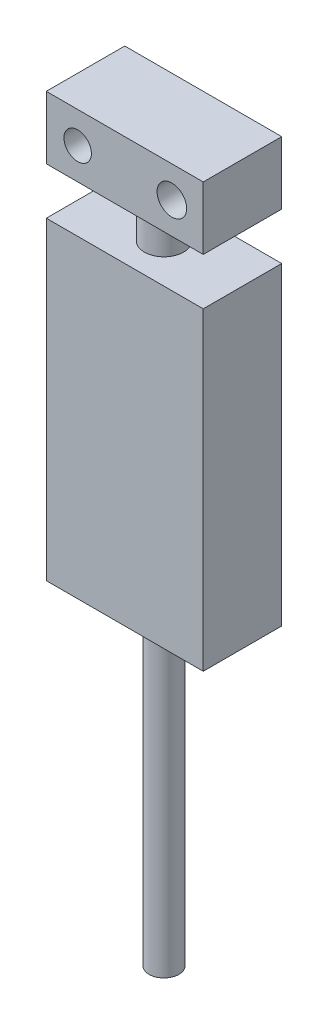
from build123d import *

# Parameters (mm, degrees)
SKETCH1_W           = 200
SKETCH1_H           = 400
BOSS_EXTRUDE1_DEPTH = 100
SKETCH2_R           = 25
BOSS_EXTRUDE2_DEPTH = 60
SKETCH3_W           = 200
SKETCH3_H           = 100
BOSS_EXTRUDE3_DEPTH = 80
SKETCH4_R           = 17.5
SKETCH4_R_2         = 18.82666719
CUT_EXTRUDE1_DEPTH  = 40
SKETCH5_R           = 19
BOSS_EXTRUDE4_DEPTH = 400
SKETCH7_R           = 10
BOSS_EXTRUDE5_DEPTH = 15


with BuildPart() as part:
    # Sketch1 → Boss-Extrude1 (new body)
    with BuildSketch(Plane.XY):
        Rectangle(SKETCH1_W, SKETCH1_H)
    extrude(amount=BOSS_EXTRUDE1_DEPTH)

    # Sketch2 → Boss-Extrude2 (add)
    with BuildSketch(Plane(origin=(0, 200, 0), x_dir=(1, 0, 0), z_dir=(0, 1, 0))):
        with Locations(Location((0, -50, 0), (0, 0, 90))):
            Circle(SKETCH2_R)
    extrude(amount=BOSS_EXTRUDE2_DEPTH)

    # Sketch3 → Boss-Extrude3 (add)
    with BuildSketch(Plane(origin=(0, 260, 0), x_dir=(1, 0, 0), z_dir=(0, 1, 0))):
        with Locations((0, -50)):
            Rectangle(SKETCH3_W, SKETCH3_H)
    extrude(amount=BOSS_EXTRUDE3_DEPTH)

    # Sketch4 → Cut-Extrude1 (cut)
    with BuildSketch(Plane.XY.offset(100)):
        with Locations((-60, 300)):
            Circle(SKETCH4_R)
        with Locations((60, 300)):
            Circle(SKETCH4_R_2)
    extrude(amount=-CUT_EXTRUDE1_DEPTH, mode=Mode.SUBTRACT)

    # Sketch5 → Boss-Extrude4 (add)
    with BuildSketch(Plane.XZ.offset(200)):
        with Locations(Location((0, 50, 0), (0, 0, 270))):
            Circle(SKETCH5_R)
    extrude(amount=BOSS_EXTRUDE4_DEPTH)

    # Sketch7 → Boss-Extrude5 (add)
    with BuildSketch(Plane(origin=(0, 0, 0), x_dir=(-1, 0, 0), z_dir=(0, 0, -1))):
        with Locations(Location((0, 175, 0), (0, 0, 180))):
            Circle(SKETCH7_R)
        with Locations(Location((-20, -65, 0), (0, 0, 180))):
            Circle(SKETCH7_R)
        with Locations(Location((40, -65, 0), (0, 0, 180))):
            Circle(SKETCH7_R)
    extrude(amount=BOSS_EXTRUDE5_DEPTH)


solid = part.part
